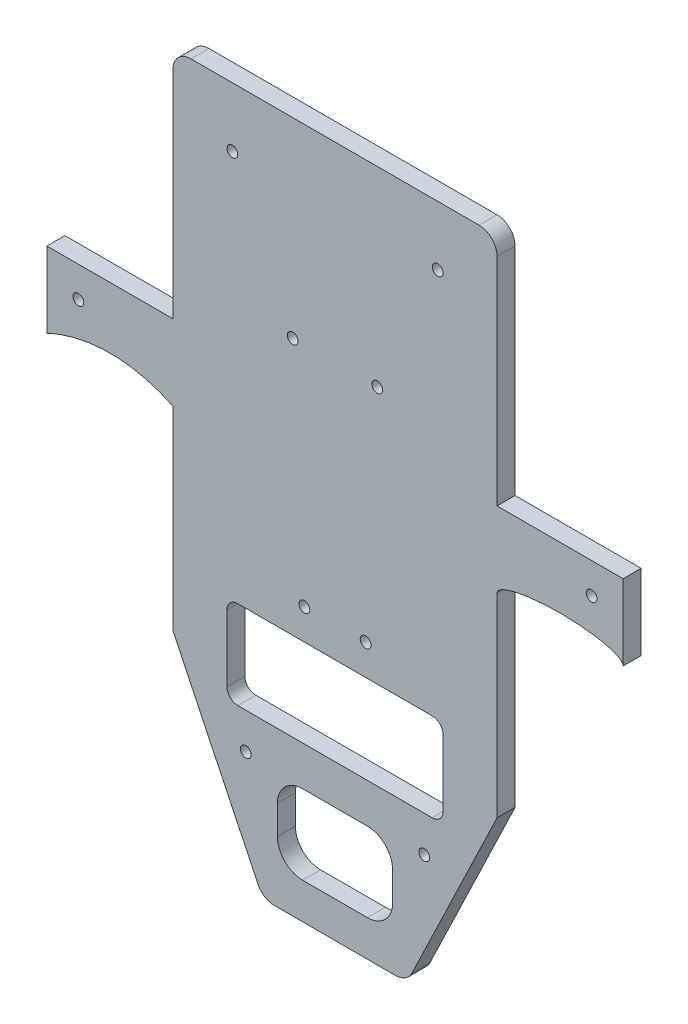
from build123d import *

# Parameters (mm, degrees)
BOSS_EXTRUDE1_DEPTH = 5
SKETCH3_R           = 1.5
CUT_EXTRUDE1_DEPTH  = 146.976025571
CUT_EXTRUDE2_DEPTH  = 146.976025571
SKETCH5_R           = 1.5
CUT_EXTRUDE3_DEPTH  = 146.976025571
CUT_EXTRUDE4_DEPTH  = 146.976025571
SKETCH7_R           = 1.5
CUT_EXTRUDE5_DEPTH  = 146.976025571


with BuildPart() as part:
    # Sketch2 → Boss-Extrude1 (new body)
    with BuildSketch(Plane.XY):
        with BuildLine():
            Line((-45, -70), (-21.362272993, -119.166472174))
            ThreePointArc((-21.362272993, -119.166472174), (-19.517555453, -121.23275093), (-16.85601087, -122))
            Line((-16.85601087, -122), (16.85601087, -122))
            ThreePointArc((16.85601087, -122), (19.517555453, -121.23275093), (21.362272993, -119.166472174))
            Line((21.362272993, -119.166472174), (45, -70))
            Line((45, -70), (45, -16))
            add(Edge.make_bspline(
                [(80, -16), (80, -12), (62.5, -12), (45, -12), (45, -16)],
                knots=[3.141592654, 3.141592654, 3.141592654, 4.71238898, 4.71238898, 6.283185307, 6.283185307, 6.283185307], degree=2, weights=[1, 0.707106781, 1, 0.707106781, 1]))
            Line((80, -16), (80, 5))
            Line((80, 5), (45, 5))
            Line((45, 5), (45, 65))
            ThreePointArc((45, 65), (43.535533906, 68.535533906), (40, 70))
            Line((40, 70), (-40, 70))
            ThreePointArc((-40, 70), (-43.535533906, 68.535533906), (-45, 65))
            Line((-45, 65), (-45, 5))
            Line((-45, 5), (-80, 5))
            Line((-80, 5), (-80, -16))
            add(Edge.make_bspline(
                [(-45, -16), (-62.5, -7.544335015), (-80, -16)],
                knots=[3.141592654, 3.141592654, 3.141592654, 4.041796627, 4.041796627, 4.041796627], degree=2, weights=[1, 0.900402737, 1]))
            Line((-45, -16), (-45, -70))
        make_face()
    extrude(amount=BOSS_EXTRUDE1_DEPTH)

    # Sketch3 → Cut-Extrude1 (cut, through all)
    with BuildSketch(Plane.XY.offset(5)):
        with Locations((-71.25, -3.49687094)):
            Circle(SKETCH3_R)
        with Locations((71.25, -3.5)):
            Circle(SKETCH3_R)
    extrude(amount=-CUT_EXTRUDE1_DEPTH, mode=Mode.SUBTRACT)

    # Sketch4 → Cut-Extrude2 (cut, through all)
    with BuildSketch(Plane.XY.offset(5)):
        with BuildLine():
            Line((-9, -90), (9, -90))
            ThreePointArc((9, -90), (13.949747468, -92.050252532), (16, -97))
            Line((16, -97), (16, -105))
            ThreePointArc((16, -105), (13.949747468, -109.949747468), (9, -112))
            Line((9, -112), (-9, -112))
            ThreePointArc((-9, -112), (-13.949747468, -109.949747468), (-16, -105))
            Line((-16, -105), (-16, -97))
            ThreePointArc((-16, -97), (-13.949747468, -92.050252532), (-9, -90))
        make_face()
    extrude(amount=-CUT_EXTRUDE2_DEPTH, mode=Mode.SUBTRACT)

    # Sketch5 → Cut-Extrude3 (cut, through all)
    with BuildSketch(Plane.XY.offset(5)):
        with Locations((11.725, 16.949973779)):
            Circle(SKETCH5_R)
        with Locations((-11.725, 16.949973779)):
            Circle(SKETCH5_R)
    extrude(amount=-CUT_EXTRUDE3_DEPTH, mode=Mode.SUBTRACT)

    # Sketch6 → Cut-Extrude4 (cut, through all)
    with BuildSketch(Plane.XY.offset(5)):
        with BuildLine():
            Line((-27, -54.5), (27, -54.5))
            ThreePointArc((27, -54.5), (29.121320344, -55.378679656), (30, -57.5))
            Line((30, -57.5), (30, -76))
            ThreePointArc((30, -76), (29.121320344, -78.121320344), (27, -79))
            Line((27, -79), (-27, -79))
            ThreePointArc((-27, -79), (-29.121320344, -78.121320344), (-30, -76))
            Line((-30, -76), (-30, -57.5))
            ThreePointArc((-30, -57.5), (-29.121320344, -55.378679656), (-27, -54.5))
        make_face()
    extrude(amount=-CUT_EXTRUDE4_DEPTH, mode=Mode.SUBTRACT)

    # Sketch7 → Cut-Extrude5 (cut, through all)
    with BuildSketch(Plane.XY.offset(5)):
        with Locations((-28.5, 53.5)):
            Circle(SKETCH7_R)
        with Locations((28.5, 53.5)):
            Circle(SKETCH7_R)
        with Locations((-24.769714049, -89)):
            Circle(SKETCH7_R)
        with Locations((24.769714049, -89)):
            Circle(SKETCH7_R)
        with Locations((-8.5, -46)):
            Circle(SKETCH7_R)
        with Locations((8.5, -46)):
            Circle(SKETCH7_R)
    extrude(amount=-CUT_EXTRUDE5_DEPTH, mode=Mode.SUBTRACT)


solid = part.part
